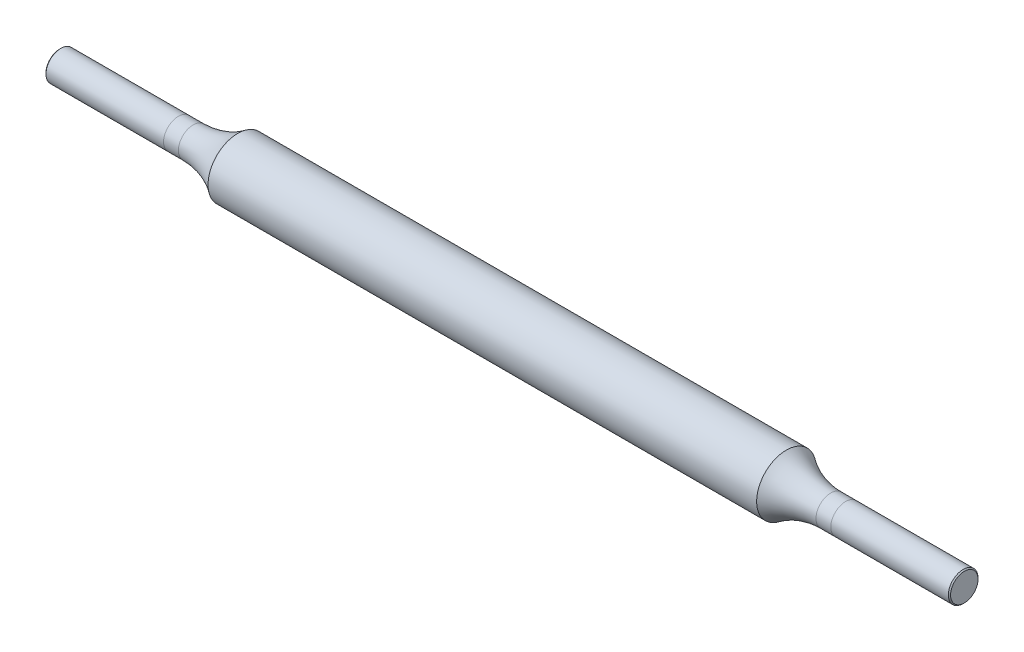
from build123d import *

# Parameters (mm, degrees)
CHAMFER1_SIZE = 0.075


with BuildPart() as part:
    # Sketch1 → Revolve1 (revolve)
    with BuildSketch(Plane.XY, mode=Mode.PRIVATE) as revolve1_sk:
        with BuildLine():
            Line((-30.49, 0), (30.49, 0))
            Line((30.49, 0), (30.49, 1))
            Line((30.49, 1), (21.49, 1))
            ThreePointArc((21.49, 1), (19.90886117, 1.25658351), (18.49, 2))
            Line((18.49, 2), (-18.49, 2))
            ThreePointArc((-18.49, 2), (-19.90886117, 1.25658351), (-21.49, 1))
            Line((-21.49, 1), (-30.49, 1))
            Line((-30.49, 1), (-30.49, 0))
        make_face()
    revolve(revolve1_sk.sketch.rotate(Axis((-30.49, 0, 0), (1, 0, 0)), 90), axis=Axis((-30.49, 0, 0), (1, 0, 0)))

    # Chamfer1
    chamfer1_edges = [part.edges().sort_by_distance(p)[0] for p in [
        (-30.49, 0, -1),
        (30.49, 0, -1),
    ]]
    chamfer(chamfer1_edges, length=CHAMFER1_SIZE)


solid = part.part
